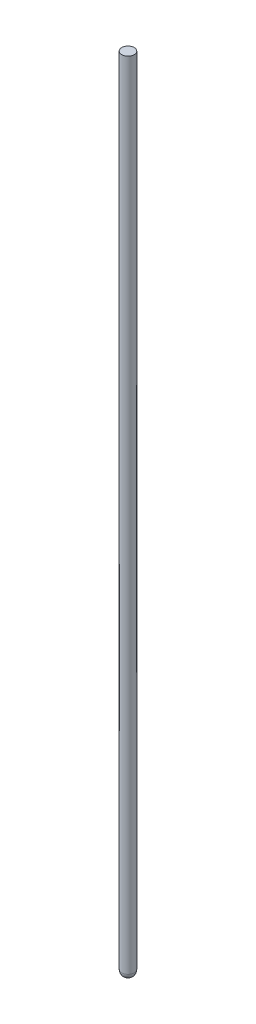
from build123d import *

# Parameters (mm, degrees)
SKETCH1_R           = 0.1984375
BOSS_EXTRUDE1_DEPTH = 25.4
DOME1_FACE_RADIUS   = 0.1984375
DOME1_HEIGHT        = 0.1984375


with BuildPart() as part:
    # Sketch1 → Boss-Extrude1 (new body)
    with BuildSketch(Plane(origin=(0, 0, 0), x_dir=(1, 0, 0), z_dir=(0, 1, 0))):
        with Locations(Location((0, 0, 0), (0, 0, 270))):
            Circle(SKETCH1_R)
    extrude(amount=BOSS_EXTRUDE1_DEPTH)

    # Dome1: a dome of height H over a round flat face of radius A is a cap of a sphere of radius (A * A + H * H) / (2 * H)
    dome1_r = (DOME1_FACE_RADIUS * DOME1_FACE_RADIUS + DOME1_HEIGHT * DOME1_HEIGHT) / (2 * DOME1_HEIGHT)
    dome1_base = Plane((0, 0, 0), z_dir=(0, -1, 0))
    with Locations(dome1_base.offset(DOME1_HEIGHT - dome1_r)):
        dome1_ball = Sphere(dome1_r, mode=Mode.PRIVATE)
    add(split(dome1_ball, bisect_by=dome1_base, keep=Keep.TOP, mode=Mode.PRIVATE))


solid = part.part
